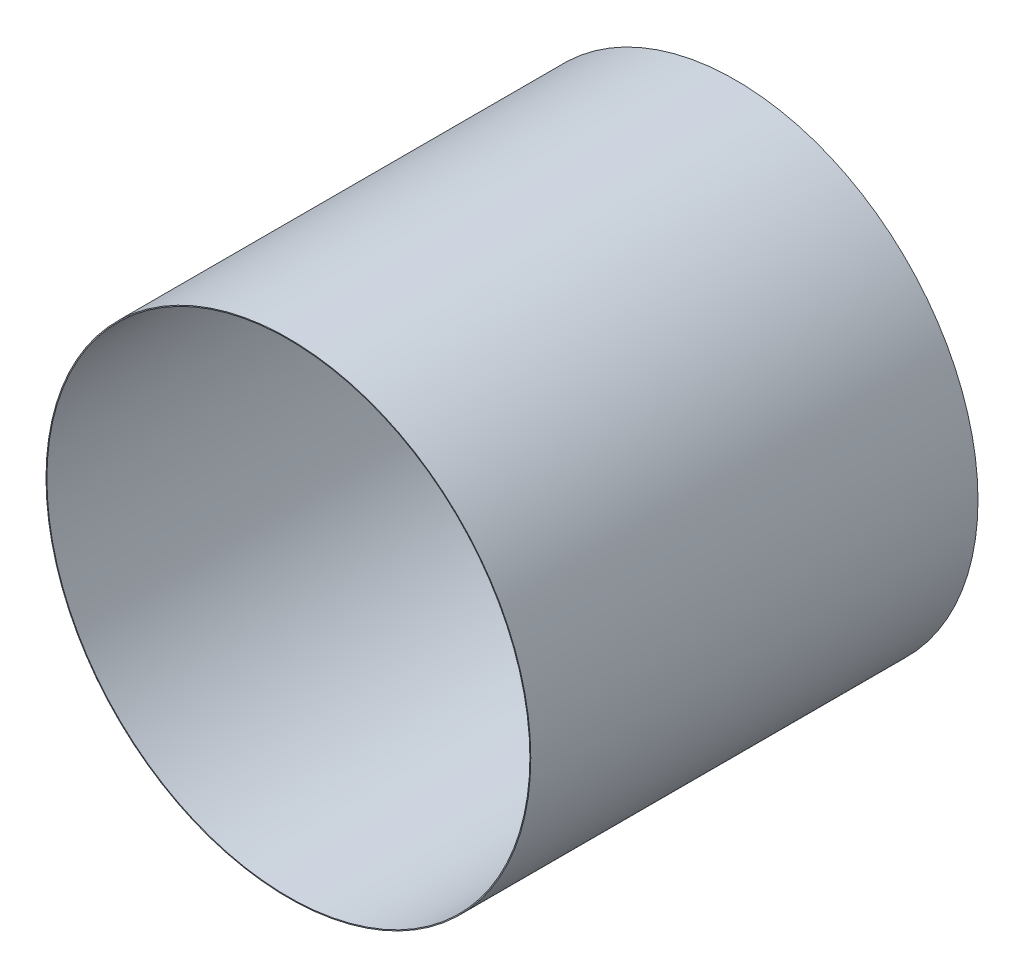
from build123d import *

# Parameters (mm, degrees)
SKETCH1_R           = 13.55
SKETCH1_R_2         = 13.5
BOSS_EXTRUDE1_DEPTH = 25


with BuildPart() as part:
    # Sketch1 → Boss-Extrude1 (new body)
    with BuildSketch(Plane.XY):
        Circle(SKETCH1_R)
        Circle(SKETCH1_R_2, mode=Mode.SUBTRACT)
    extrude(amount=BOSS_EXTRUDE1_DEPTH)


solid = part.part
